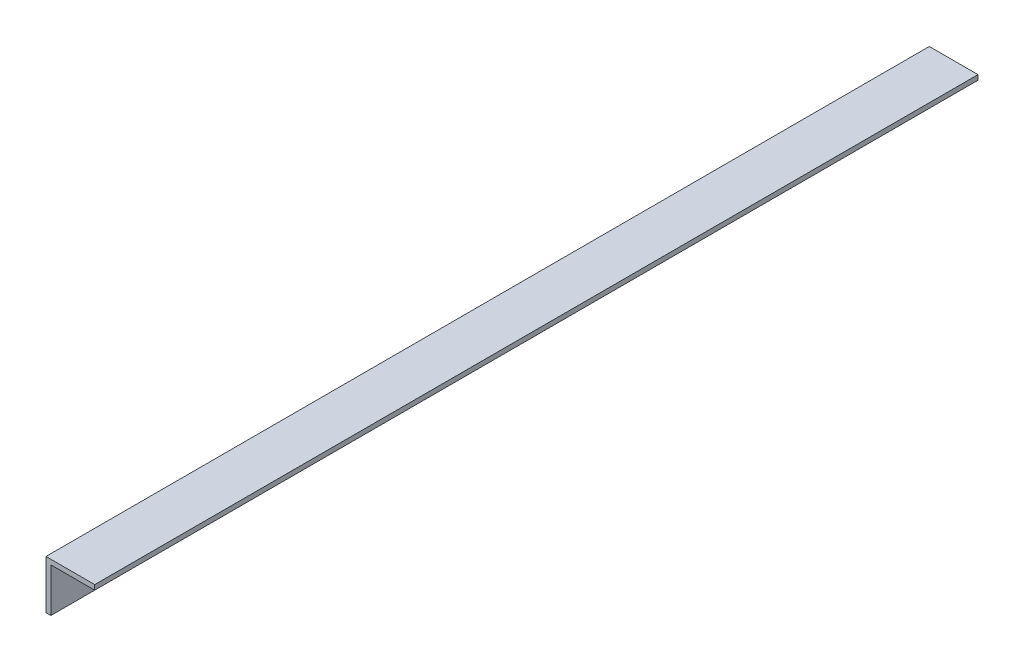
from build123d import *

# Parameters (mm, degrees)
EXTRUDE_THIN1_DEPTH = 460.375


with BuildPart() as part:
    # Sketch1 → Extrude-Thin1 (new body)
    with BuildSketch(Plane.XY):
        Polygon((-25.4, -25.4), (-25.4, 0), (0, 0), (0, -2.54), (-22.86, -2.54), (-22.86, -25.4), align=None)
    extrude(amount=EXTRUDE_THIN1_DEPTH)


solid = part.part
